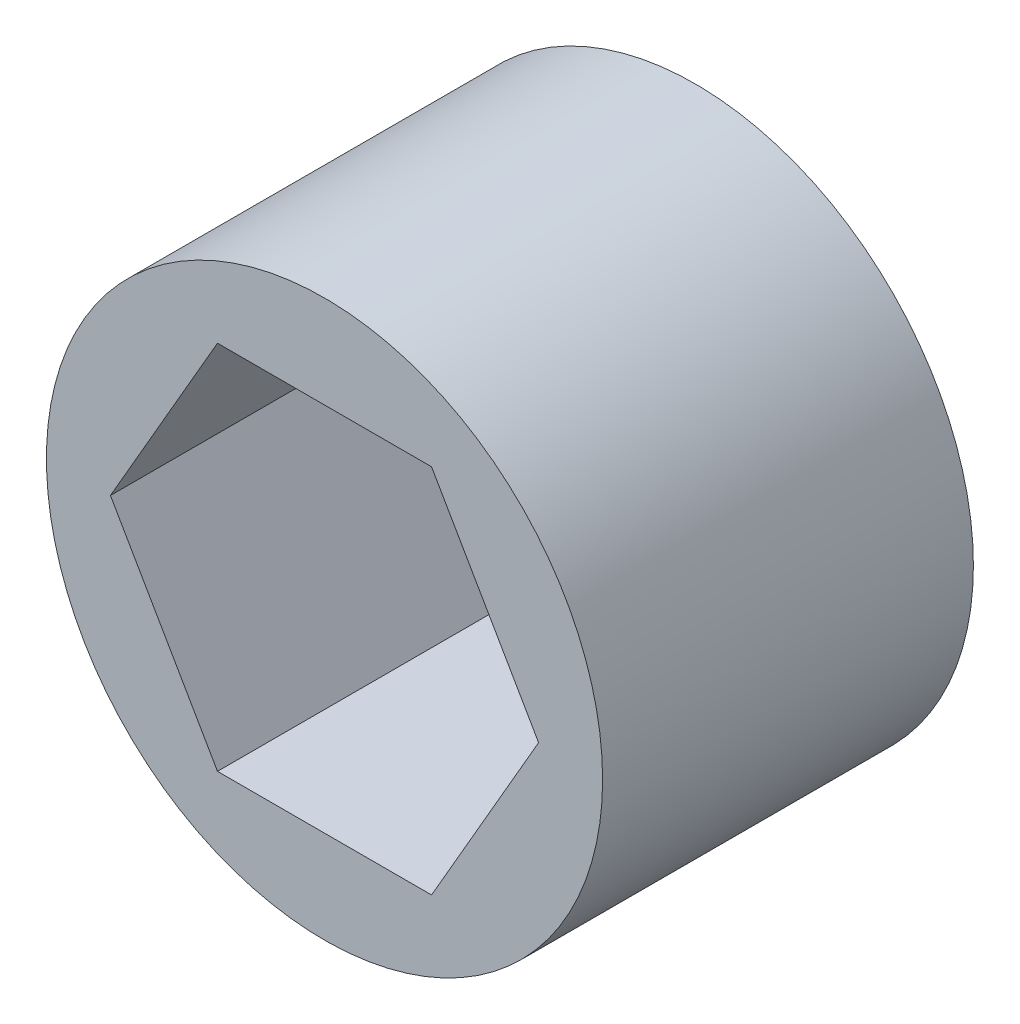
from build123d import *

# Parameters (mm, degrees)
SKETCH1_R           = 9.525
BOSS_EXTRUDE1_DEPTH = 12.7


with BuildPart() as part:
    # Sketch1 → Boss-Extrude1 (new body)
    with BuildSketch(Plane.XY):
        Circle(SKETCH1_R)
        Polygon((7.332348419, 0), (3.666174209, 6.35), (-3.666174209, 6.35), (-7.332348419, 0), (-3.666174209, -6.35), (3.666174209, -6.35), align=None, mode=Mode.SUBTRACT)
    extrude(amount=BOSS_EXTRUDE1_DEPTH)


solid = part.part
